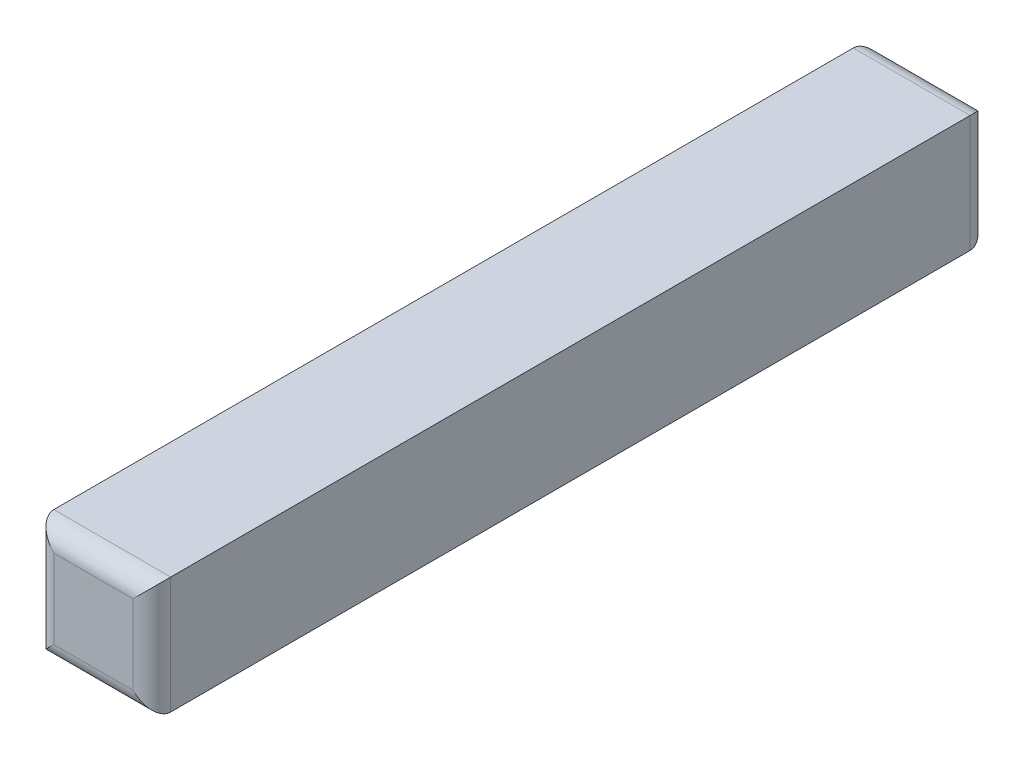
from build123d import *

# Parameters (mm, degrees)
ESQUISSE1_W        = 0.62
ESQUISSE1_H        = 0.62
BOSS_EXTRU_1_DEPTH = 4.44
CONG_2_R           = 0.1


with BuildPart() as part:
    # Esquisse1 → Boss.-Extru.1 (new body)
    with BuildSketch(Plane.XY):
        with Locations((0.31, -0.31)):
            Rectangle(ESQUISSE1_W, ESQUISSE1_H)
    extrude(amount=BOSS_EXTRU_1_DEPTH)

    # Congé2
    cong_2_edges = [part.edges().sort_by_distance(p)[0] for p in [
        (0.62, -0.31, 4.44),
        (0.31, 0, 4.44),
        (0, -0.31, 4.44),
        (0.31, 0, 0),
        (0.62, -0.31, 0),
        (0.31, -0.62, 0),
        (0, -0.31, 0),
        (0.31, -0.62, 4.44),
    ]]
    fillet(cong_2_edges, radius=CONG_2_R)


solid = part.part
